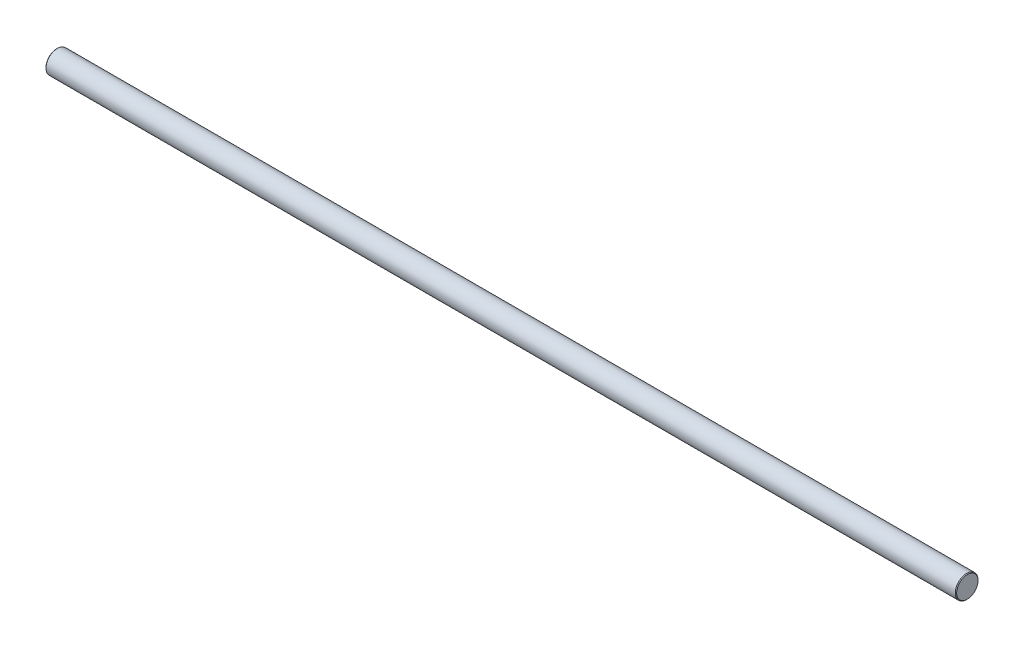
from build123d import *


with BuildPart() as part:
    # 草圖1 → 旋轉1 (revolve)
    with BuildSketch(Plane.XY, mode=Mode.PRIVATE) as revolve_1_sk:
        Polygon((0, 0), (0, 7.5), (0.5, 8), (639.5, 8), (640, 7.5), (640, 0), align=None)
    revolve(revolve_1_sk.sketch.rotate(Axis((640, 0, 0), (-1, 0, 0)), 270), axis=Axis((640, 0, 0), (-1, 0, 0)))


solid = part.part
